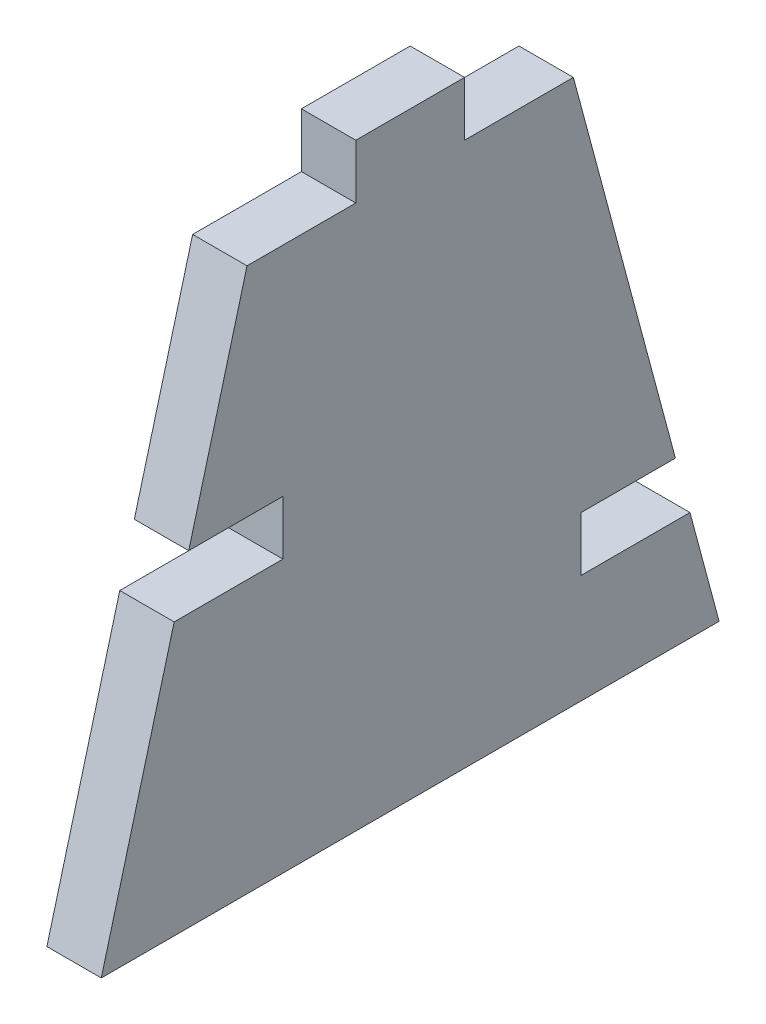
from build123d import *

# Parameters (mm, degrees)
BOSS_EXTRUDE1_DEPTH = 10


with BuildPart() as part:
    # Sketch1 → Boss-Extrude1 (new body)
    with BuildSketch(Plane(origin=(0, 0, 0), x_dir=(0, 0, -1), z_dir=(1, 0, 0))):
        Polygon((56.794919243, 0), (-56.794919243, 0), (-43.397459622, 50), (-23.397459622, 50), (-23.397459622, 60), (-40.717967697, 60), (-30, 100), (-10, 100), (-10, 110), (10, 110), (10, 100), (30, 100), (48.75644347, 30), (31.435935394, 30), (31.435935394, 20), (51.435935394, 20), align=None)
    extrude(amount=BOSS_EXTRUDE1_DEPTH)


solid = part.part
